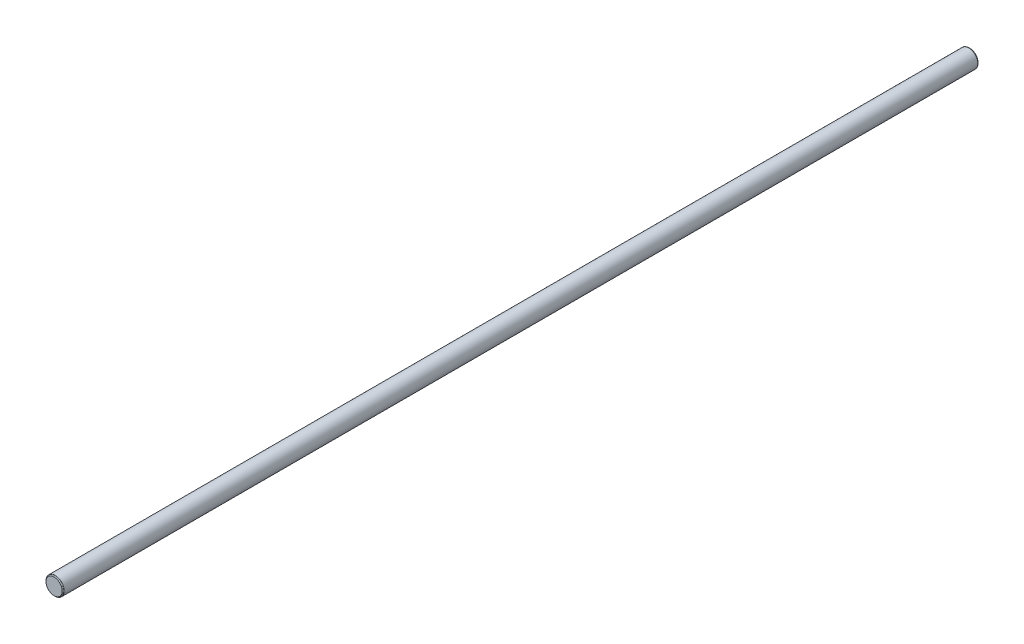
from build123d import *

# Parameters (mm, degrees)
SKETCH3_R           = 3
BOSS_EXTRUDE1_DEPTH = 152.4
CHAMFER1_SIZE       = 0.3
FILLET1_R           = 0.225


with BuildPart() as part:
    # Sketch3 → Boss-Extrude1 (new, symmetric)
    with BuildSketch(Plane.XY):
        with Locations(Location((0, 0, 0), (0, 0, 180))):
            Circle(SKETCH3_R)
    extrude(amount=BOSS_EXTRUDE1_DEPTH, both=True)

    # Chamfer1
    chamfer1_edges = [part.edges().sort_by_distance(p)[0] for p in [
        (3, 0, -152.4),
        (3, 0, 152.4),
    ]]
    chamfer(chamfer1_edges, length=CHAMFER1_SIZE)

    # Fillet1
    fillet1_edges = [part.edges().sort_by_distance(p)[0] for p in [
        (3, 0, 152.1),
        (3, 0, -152.1),
    ]]
    fillet(fillet1_edges, radius=FILLET1_R)


solid = part.part
